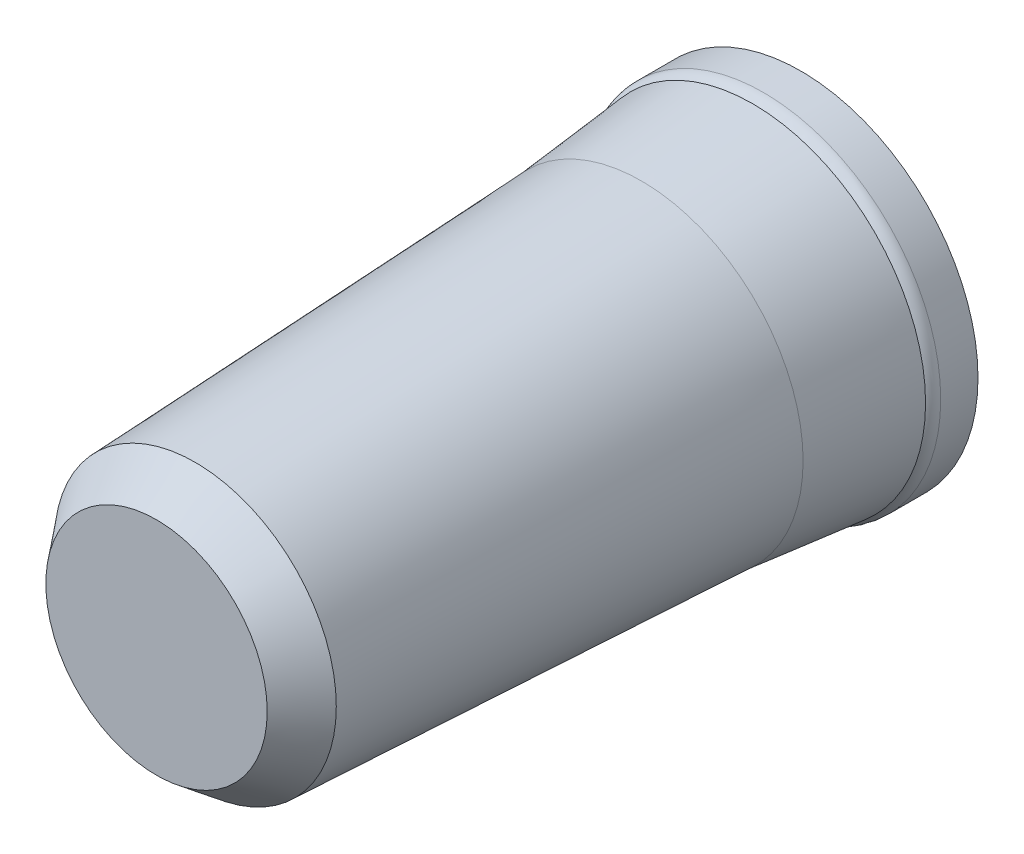
from build123d import *


with BuildPart() as part:
    # Sketch1 → Revolve1 (revolve)
    with BuildSketch(Plane(origin=(0, 0, 0), x_dir=(0, 0, -1), z_dir=(1, 0, 0)), mode=Mode.PRIVATE) as revolve1_sk:
        with BuildLine():
            Line((0, 0), (0, 22.1))
            Line((0, 22.1), (-4.651172639, 22.1))
            ThreePointArc((-4.651172639, 22.1), (-5.377505127, 21.959321235), (-5.998789585, 21.557631031))
            Line((-5.998789585, 21.557631031), (-19.875910061, 20.154612587))
            Line((-19.875910061, 20.154612587), (-75.557235443, 17.596805116))
            Line((-75.557235443, 17.596805116), (-80.39, 13.810082113))
            Line((-80.39, 13.810082113), (-80.39, 0))
            Line((-80.39, 0), (0, 0))
        make_face()
    revolve(revolve1_sk.sketch.rotate(Axis((0, 0, 0), (0, 0, -1)), 90), axis=Axis((0, 0, 0), (0, 0, -1)))


solid = part.part
